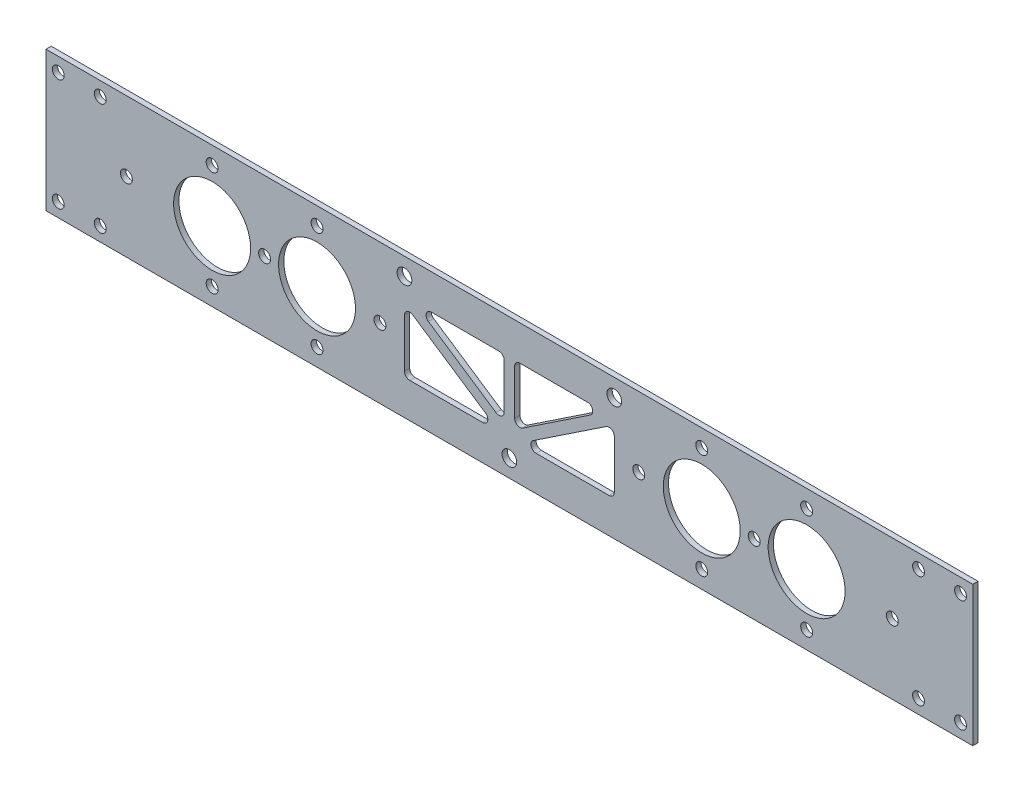
from build123d import *

# Parameters (mm, degrees)
SKETCH_1_W          = 265
SKETCH_1_H          = 40
EXTRUDE_1_DEPTH     = 1.5
SKETCH_2_R          = 11
SKETCH_2_R_2        = 2.1
CUT_EXTRUDE_1_DEPTH = 135.009328034
SKETCH_3_R          = 2.1
SKETCH_3_R_2        = 11
SKETCH_3_R_3        = 1.7
CUT_EXTRUDE_2_DEPTH = 135.009328034
SKETCH_4_R          = 1.7
CUT_EXTRUDE_3_DEPTH = 135.009328034


with BuildPart() as part:
    # 草图1 → 凸台-拉伸1 (new body)
    with BuildSketch(Plane.XY):
        Rectangle(SKETCH_1_W, SKETCH_1_H)
    extrude(amount=EXTRUDE_1_DEPTH)

    # 草图2 → 切除-拉伸1 (cut, through all)
    with BuildSketch(Plane.XY.offset(1.5)):
        with Locations((85, 0)):
            Circle(SKETCH_2_R)
        with Locations((55, 0)):
            Circle(SKETCH_2_R)
        with Locations((0, -15)):
            Circle(SKETCH_2_R_2)
        with Locations((30, 15)):
            Circle(SKETCH_2_R_2)
        with Locations((-30, 15)):
            Circle(SKETCH_2_R_2)
        with Locations((-55, 0)):
            Circle(SKETCH_2_R)
        with Locations((-85, 0)):
            Circle(SKETCH_2_R)
        with BuildLine():
            Line((30, -8.5), (30, 5.394448725))
            ThreePointArc((30, 5.394448725), (29.207786888, 6.716960623), (27.667949706, 6.642524166))
            Line((27.667949706, 6.642524166), (6.826276619, -7.251924558))
            ThreePointArc((6.826276619, -7.251924558), (6.222688873, -8.934676223), (7.658326913, -10))
            Line((7.658326913, -10), (28.5, -10))
            ThreePointArc((28.5, -10), (29.560660172, -9.560660172), (30, -8.5))
        make_face()
        with BuildLine():
            Line((3.832050294, -5.642524166), (23.173723381, 7.251924558))
            ThreePointArc((23.173723381, 7.251924558), (23.777311127, 8.934676223), (22.341673087, 10))
            Line((22.341673087, 10), (3, 10))
            ThreePointArc((3, 10), (1.939339828, 9.560660172), (1.5, 8.5))
            Line((1.5, 8.5), (1.5, -4.394448725))
            ThreePointArc((1.5, -4.394448725), (2.292213112, -5.716960623), (3.832050294, -5.642524166))
        make_face()
        with BuildLine():
            Line((-1.5, -4.394448725), (-1.5, 8.5))
            ThreePointArc((-1.5, 8.5), (-1.939339828, 9.560660172), (-3, 10))
            Line((-3, 10), (-22.341673087, 10))
            ThreePointArc((-22.341673087, 10), (-23.777311127, 8.934676223), (-23.173723381, 7.251924558))
            Line((-23.173723381, 7.251924558), (-3.832050294, -5.642524166))
            ThreePointArc((-3.832050294, -5.642524166), (-2.292213112, -5.716960623), (-1.5, -4.394448725))
        make_face()
        with BuildLine():
            Line((-6.826276619, -7.251924558), (-27.667949706, 6.642524166))
            ThreePointArc((-27.667949706, 6.642524166), (-29.207786888, 6.716960623), (-30, 5.394448725))
            Line((-30, 5.394448725), (-30, -8.5))
            ThreePointArc((-30, -8.5), (-29.560660172, -9.560660172), (-28.5, -10))
            Line((-28.5, -10), (-7.658326913, -10))
            ThreePointArc((-7.658326913, -10), (-6.222688873, -8.934676223), (-6.826276619, -7.251924558))
        make_face()
    extrude(amount=-CUT_EXTRUDE_1_DEPTH, mode=Mode.SUBTRACT)

    # 草图3 → 切除-拉伸2 (cut, through all)
    with BuildSketch(Plane(origin=(0, 0, 0), x_dir=(-1, 0, 0), z_dir=(0, 0, -1))):
        with Locations(Location((0, -15, 0), (0, 0, 180))):
            Circle(SKETCH_3_R)
        with Locations(Location((-30, 15, 0), (0, 0, 180))):
            Circle(SKETCH_3_R)
        with Locations(Location((30, 15, 0), (0, 0, 180))):
            Circle(SKETCH_3_R)
        with Locations(Location((85, 0, 0), (0, 0, 180))):
            Circle(SKETCH_3_R_2)
        with Locations(Location((55, 0, 0), (0, 0, 180))):
            Circle(SKETCH_3_R_2)
        with Locations(Location((-55, 0, 0), (0, 0, 180))):
            Circle(SKETCH_3_R_2)
        with Locations(Location((-85, 0, 0), (0, 0, 180))):
            Circle(SKETCH_3_R_2)
        with Locations((-55, -15)):
            Circle(SKETCH_3_R_3)
        with Locations((55, 15)):
            Circle(SKETCH_3_R_3)
        with Locations((-70, 0)):
            Circle(SKETCH_3_R_3)
        with Locations((-55, 15)):
            Circle(SKETCH_3_R_3)
        with Locations((85, 15)):
            Circle(SKETCH_3_R_3)
        with Locations((-85, 15)):
            Circle(SKETCH_3_R_3)
        with Locations((55, -15)):
            Circle(SKETCH_3_R_3)
        with Locations((85, -15)):
            Circle(SKETCH_3_R_3)
        with Locations((-37, 0)):
            Circle(SKETCH_3_R_3)
        with Locations((37, 0)):
            Circle(SKETCH_3_R_3)
        with Locations((109.5, 0)):
            Circle(SKETCH_3_R_3)
        with Locations((-85, -15)):
            Circle(SKETCH_3_R_3)
        with Locations((-109.5, 0)):
            Circle(SKETCH_3_R_3)
        with Locations((70, 0)):
            Circle(SKETCH_3_R_3)
        with BuildLine():
            Line((-1.5, -4.394448725), (-1.5, 8.5))
            ThreePointArc((-1.5, 8.5), (-1.939339828, 9.560660172), (-3, 10))
            Line((-3, 10), (-22.341673087, 10))
            ThreePointArc((-22.341673087, 10), (-23.777311127, 8.934676223), (-23.173723381, 7.251924558))
            Line((-23.173723381, 7.251924558), (-3.832050294, -5.642524166))
            ThreePointArc((-3.832050294, -5.642524166), (-2.292213112, -5.716960623), (-1.5, -4.394448725))
        make_face()
        with BuildLine():
            Line((30, -8.5), (30, 5.394448725))
            ThreePointArc((30, 5.394448725), (29.207786888, 6.716960623), (27.667949706, 6.642524166))
            Line((27.667949706, 6.642524166), (6.826276619, -7.251924558))
            ThreePointArc((6.826276619, -7.251924558), (6.222688873, -8.934676223), (7.658326913, -10))
            Line((7.658326913, -10), (28.5, -10))
            ThreePointArc((28.5, -10), (29.560660172, -9.560660172), (30, -8.5))
        make_face()
        with BuildLine():
            Line((3.832050294, -5.642524166), (23.173723381, 7.251924558))
            ThreePointArc((23.173723381, 7.251924558), (23.777311127, 8.934676223), (22.341673087, 10))
            Line((22.341673087, 10), (3, 10))
            ThreePointArc((3, 10), (1.939339828, 9.560660172), (1.5, 8.5))
            Line((1.5, 8.5), (1.5, -4.394448725))
            ThreePointArc((1.5, -4.394448725), (2.292213112, -5.716960623), (3.832050294, -5.642524166))
        make_face()
        with BuildLine():
            Line((-6.826276619, -7.251924558), (-27.667949706, 6.642524166))
            ThreePointArc((-27.667949706, 6.642524166), (-29.207786888, 6.716960623), (-30, 5.394448725))
            Line((-30, 5.394448725), (-30, -8.5))
            ThreePointArc((-30, -8.5), (-29.560660172, -9.560660172), (-28.5, -10))
            Line((-28.5, -10), (-7.658326913, -10))
            ThreePointArc((-7.658326913, -10), (-6.222688873, -8.934676223), (-6.826276619, -7.251924558))
        make_face()
    extrude(amount=-CUT_EXTRUDE_2_DEPTH, mode=Mode.SUBTRACT)

    # 草图4 → 切除-拉伸3 (cut, through all)
    with BuildSketch(Plane(origin=(0, 0, 0), x_dir=(-1, 0, 0), z_dir=(0, 0, -1))):
        with Locations((-129, -16)):
            Circle(SKETCH_4_R)
        with Locations((-129, 16)):
            Circle(SKETCH_4_R)
        with Locations((-117, -16)):
            Circle(SKETCH_4_R)
        with Locations((-117, 16)):
            Circle(SKETCH_4_R)
        with Locations(Location((117, 16, 0), (0, 0, 180))):
            Circle(SKETCH_4_R)
        with Locations(Location((117, -16, 0), (0, 0, 180))):
            Circle(SKETCH_4_R)
        with Locations(Location((129, 16, 0), (0, 0, 180))):
            Circle(SKETCH_4_R)
        with Locations(Location((129, -16, 0), (0, 0, 180))):
            Circle(SKETCH_4_R)
    extrude(amount=-CUT_EXTRUDE_3_DEPTH, mode=Mode.SUBTRACT)


solid = part.part
